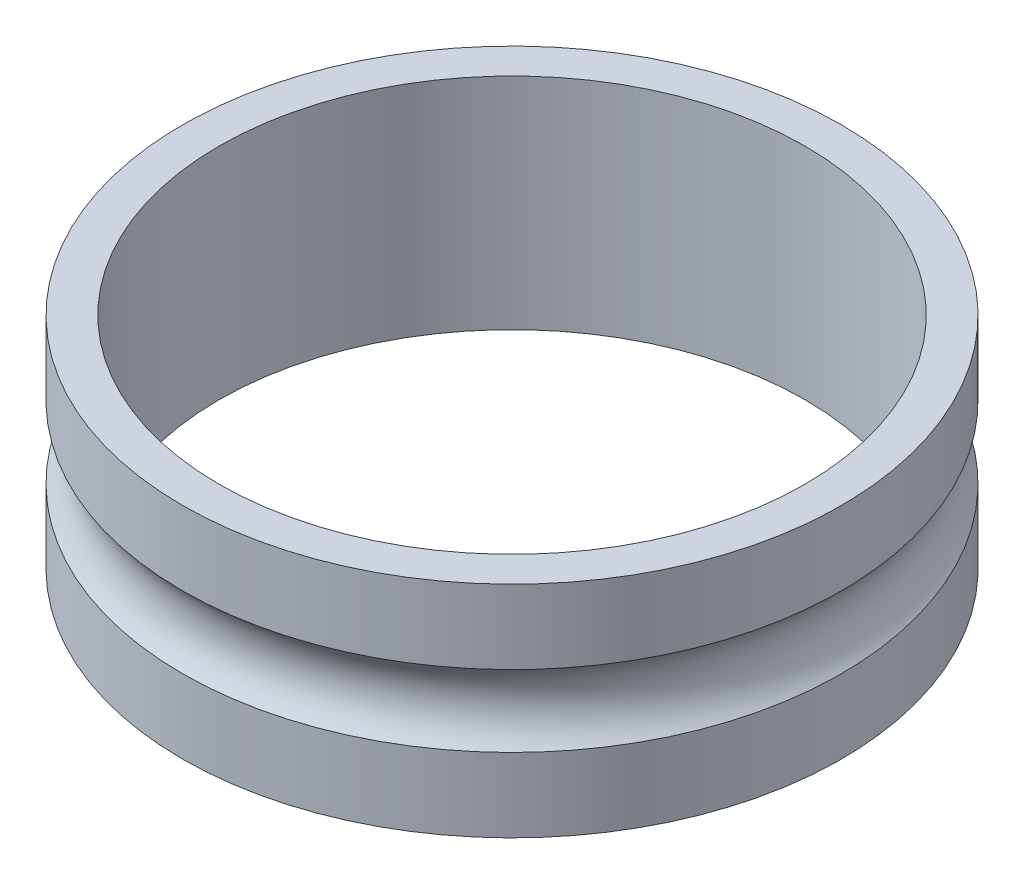
from build123d import *

# Parameters (mm, degrees)
DIAMETER_PROFILE_SKETCH_R     = 4.5
DIAMETER_PROFILE_SKETCH_R_2   = 4
DIAMETER_PROFILE_DEPTH        = 1.5
BEARING_PATH_PROFILE_SKETCH_R = 0.7


with BuildPart() as part:
    # Diameter Profile Sketch → Diameter Profile (new, symmetric)
    with BuildSketch(Plane(origin=(0, 0, 0), x_dir=(1, 0, 0), z_dir=(0, 1, 0))):
        with Locations(Location((0, 0, 0), (0, 0, 270))):
            Circle(DIAMETER_PROFILE_SKETCH_R)
        with Locations(Location((0, 0, 0), (0, 0, 270))):
            Circle(DIAMETER_PROFILE_SKETCH_R_2, mode=Mode.SUBTRACT)
    extrude(amount=DIAMETER_PROFILE_DEPTH, both=True)

    # Bearing Path Profile Sketch → Bearing Path Profile (revolve, cut)
    with BuildSketch(Plane.XY, mode=Mode.PRIVATE) as bearing_path_profile_sk:
        with Locations((5, 0)):
            Circle(BEARING_PATH_PROFILE_SKETCH_R)
    revolve(bearing_path_profile_sk.sketch.rotate(Axis((0, 1.5, 0), (0, -1, 0)), 90), axis=Axis((0, 1.5, 0), (0, -1, 0)), mode=Mode.SUBTRACT)


solid = part.part
